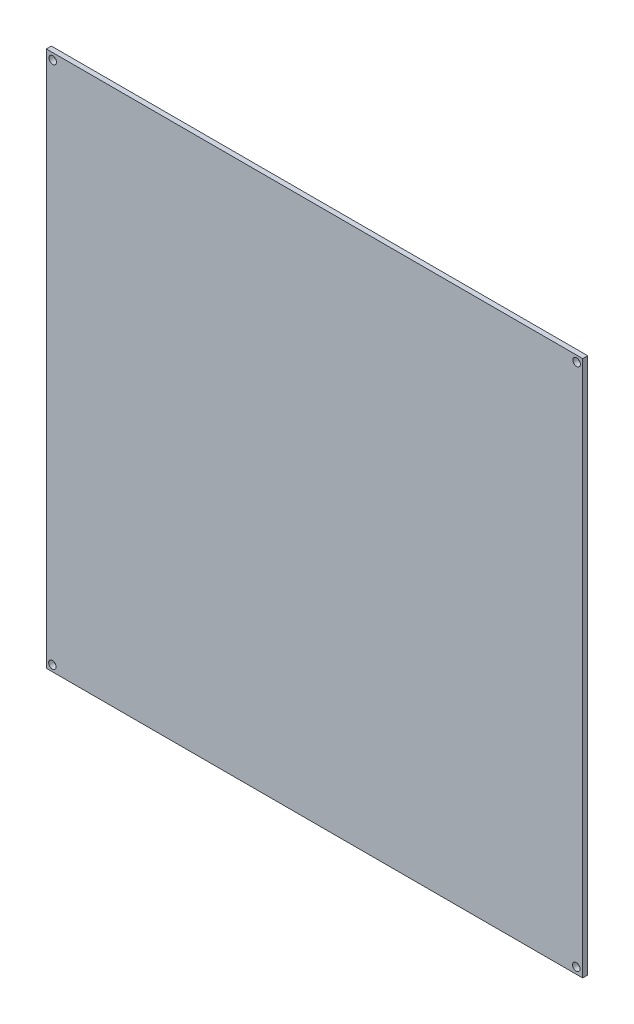
from build123d import *

# Parameters (mm, degrees)
SKETCH1_W           = 214
SKETCH1_H           = 214
SKETCH1_R           = 1.5
BOSS_EXTRUDE1_DEPTH = 2


with BuildPart() as part:
    # Sketch1 → Boss-Extrude1 (new body)
    with BuildSketch(Plane.XY):
        Rectangle(SKETCH1_W, SKETCH1_H)
        with Locations((-104.43480489, 104.43480489)):
            Circle(SKETCH1_R, mode=Mode.SUBTRACT)
        with Locations((104.56519511, 104.56519511)):
            Circle(SKETCH1_R, mode=Mode.SUBTRACT)
        with Locations((104.43480489, -104.43480489)):
            Circle(SKETCH1_R, mode=Mode.SUBTRACT)
        with Locations((-104.56519511, -104.56519511)):
            Circle(SKETCH1_R, mode=Mode.SUBTRACT)
    extrude(amount=BOSS_EXTRUDE1_DEPTH)


solid = part.part
